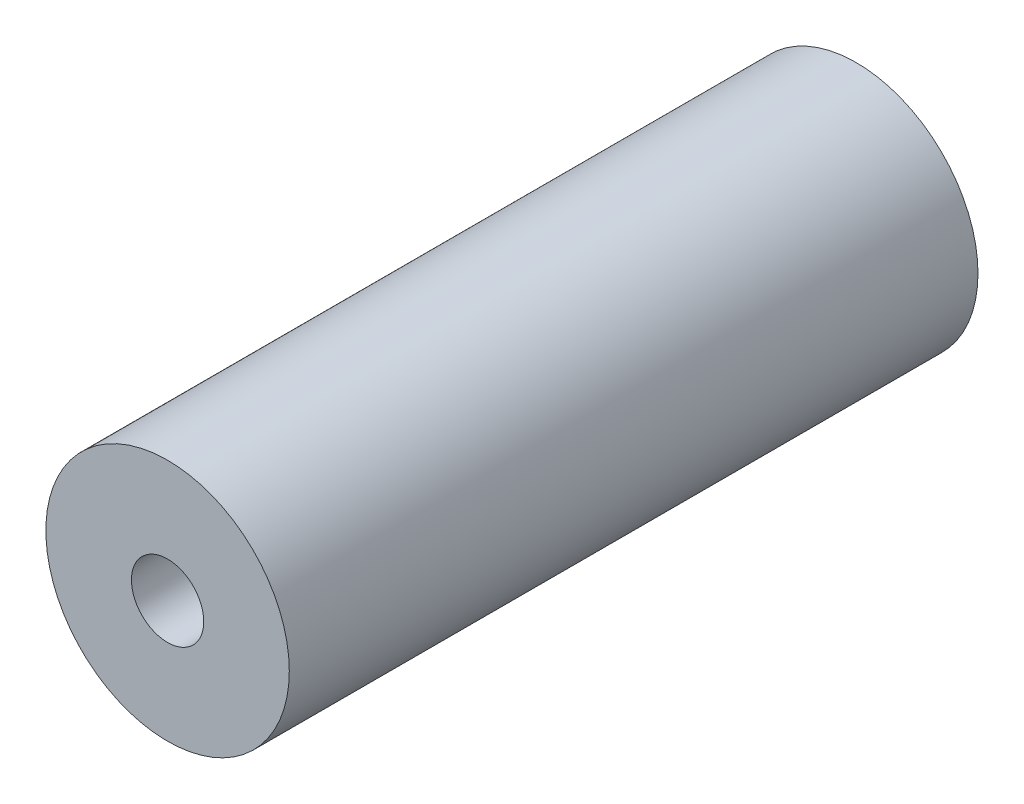
from build123d import *

# Parameters (mm, degrees)
SKETCH1_R                 = 7.07
BOSS_EXTRUDE1_DEPTH       = 40
M5X0_8_TAPPED_HOLE1_D     = 4.2
M5X0_8_TAPPED_HOLE1_DEPTH = 12.4
M5X0_8_TAPPED_HOLE1_TIP   = 1.2618073
M5X0_8_TAPPED_HOLE3_D     = 4.2
M5X0_8_TAPPED_HOLE3_DEPTH = 12.4
M5X0_8_TAPPED_HOLE3_TIP   = 1.2618073


with BuildPart() as part:
    # Sketch1 → Boss-Extrude1 (new body)
    with BuildSketch(Plane(origin=(0, 0, 0), x_dir=(0, 1, 0), z_dir=(0, 0, 1))):
        with Locations(Location((0, 0, 0), (0, 0, 270))):
            Circle(SKETCH1_R)
    extrude(amount=BOSS_EXTRUDE1_DEPTH)

    # M5x0.8 Tapped Hole1
    with Locations(Plane.XY.offset(40)):
        with Locations((0, 0)):
            Hole(M5X0_8_TAPPED_HOLE1_D / 2, depth=M5X0_8_TAPPED_HOLE1_DEPTH)
            with Locations((0, 0, -(M5X0_8_TAPPED_HOLE1_DEPTH + M5X0_8_TAPPED_HOLE1_TIP / 2))):  # 118° drill point
                Cone(0, M5X0_8_TAPPED_HOLE1_D / 2, M5X0_8_TAPPED_HOLE1_TIP, mode=Mode.SUBTRACT)

    # M5x0.8 Tapped Hole3
    with Locations(Plane(origin=(0, 0, 0), x_dir=(-1, 0, 0), z_dir=(0, 0, -1))):
        with Locations((0, 0)):
            Hole(M5X0_8_TAPPED_HOLE3_D / 2, depth=M5X0_8_TAPPED_HOLE3_DEPTH)
            with Locations((0, 0, -(M5X0_8_TAPPED_HOLE3_DEPTH + M5X0_8_TAPPED_HOLE3_TIP / 2))):  # 118° drill point
                Cone(0, M5X0_8_TAPPED_HOLE3_D / 2, M5X0_8_TAPPED_HOLE3_TIP, mode=Mode.SUBTRACT)


solid = part.part
